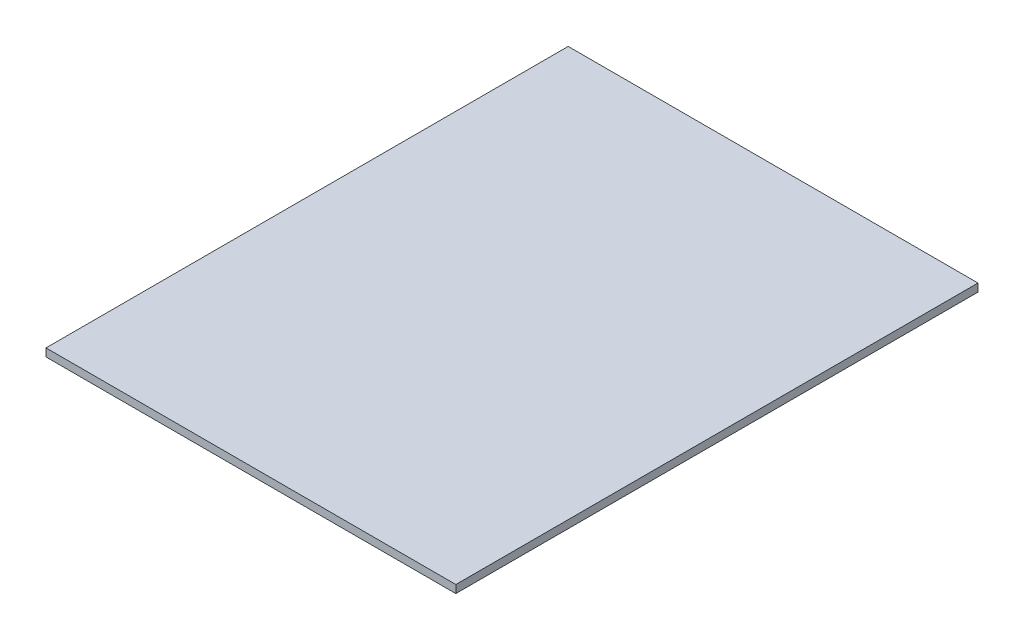
from build123d import *

# Parameters (mm, degrees)
SKETCH1_W           = 104.1
SKETCH1_H           = 132.64
BOSS_EXTRUDE1_DEPTH = 2


with BuildPart() as part:
    # Sketch1 → Boss-Extrude1 (new body)
    with BuildSketch(Plane.XZ.offset(2.1)):
        Rectangle(SKETCH1_W, SKETCH1_H)
    extrude(amount=BOSS_EXTRUDE1_DEPTH)


solid = part.part
